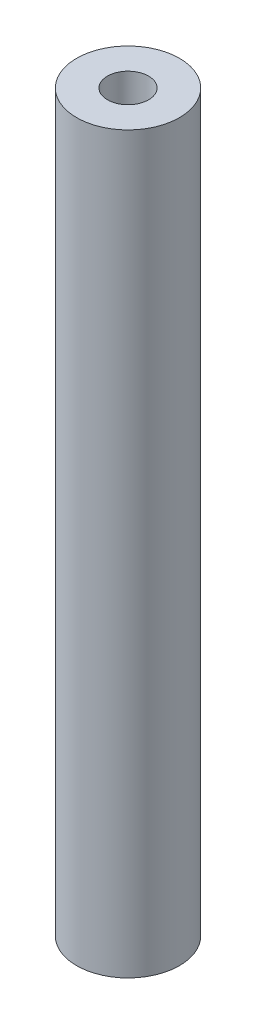
from build123d import *

# Parameters (mm, degrees)
SKETCH1_R           = 2.5
SKETCH1_R_2         = 1
BOSS_EXTRUDE1_DEPTH = 35.7


with BuildPart() as part:
    # Sketch1 → Boss-Extrude1 (new body)
    with BuildSketch(Plane(origin=(0, 0, 0), x_dir=(1, 0, 0), z_dir=(0, 1, 0))):
        with Locations(Location((0, 0, 0), (0, 0, 90))):
            Circle(SKETCH1_R)
        with Locations(Location((0, 0, 0), (0, 0, 90))):
            Circle(SKETCH1_R_2, mode=Mode.SUBTRACT)
    extrude(amount=BOSS_EXTRUDE1_DEPTH)


solid = part.part
